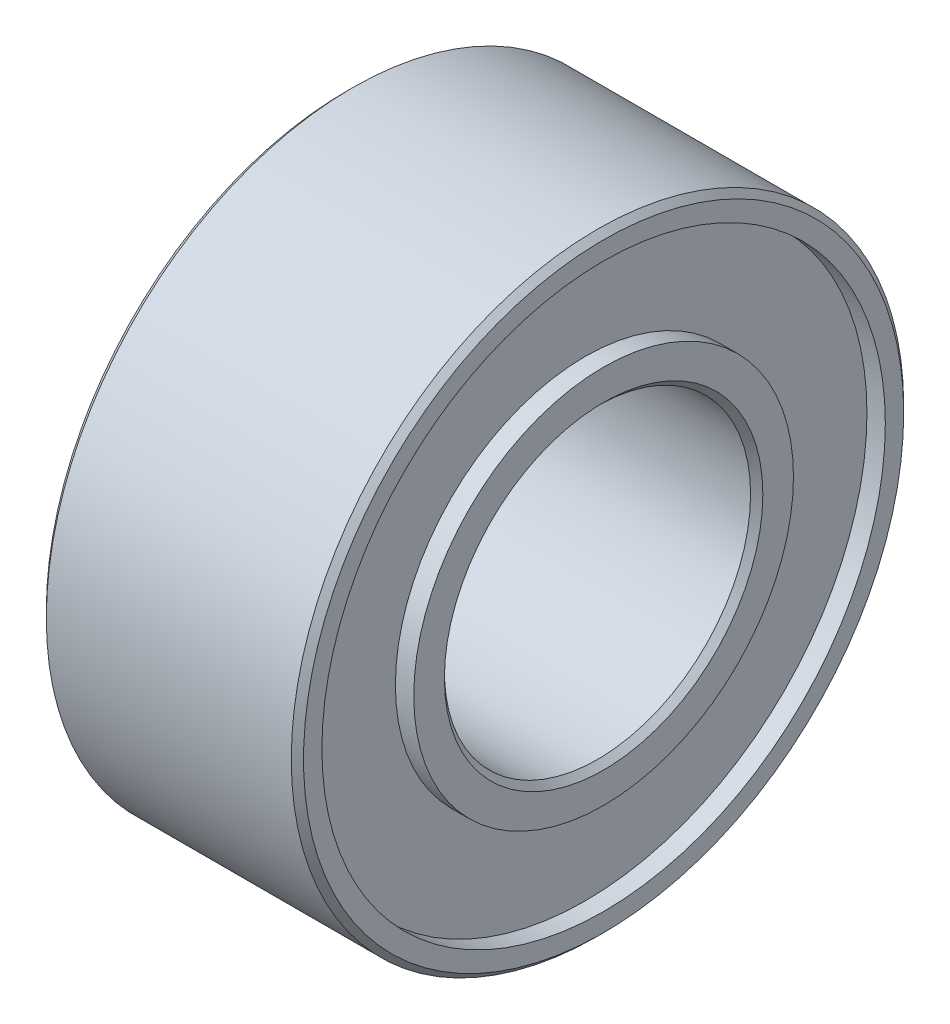
from build123d import *

# Parameters (mm, degrees)
CHAMFER1_SIZE = 0.1


with BuildPart() as part:
    # Sketch1 → Revolve1 (revolve)
    with BuildSketch(Plane.XY, mode=Mode.PRIVATE) as revolve1_sk:
        Polygon((2.1, 2.5), (-2.1, 2.5), (-2.1, 3.1), (-1.8, 3.1), (-1.8, 4.6), (-2.1, 4.6), (-2.1, 5), (2.1, 5), (2.1, 4.6), (1.8, 4.6), (1.8, 3.1), (2.1, 3.1), align=None)
    revolve(revolve1_sk.sketch.rotate(Axis((0, 0, 0), (-1, 0, 0)), 90), axis=Axis((0, 0, 0), (-1, 0, 0)))

    # Chamfer1
    chamfer1_edges = [part.edges().sort_by_distance(p)[0] for p in [
        (2.1, 0, 5),
        (-2.1, 0, 5),
        (-2.1, 0, 2.5),
        (2.1, 0, 2.5),
    ]]
    chamfer(chamfer1_edges, length=CHAMFER1_SIZE)


solid = part.part
